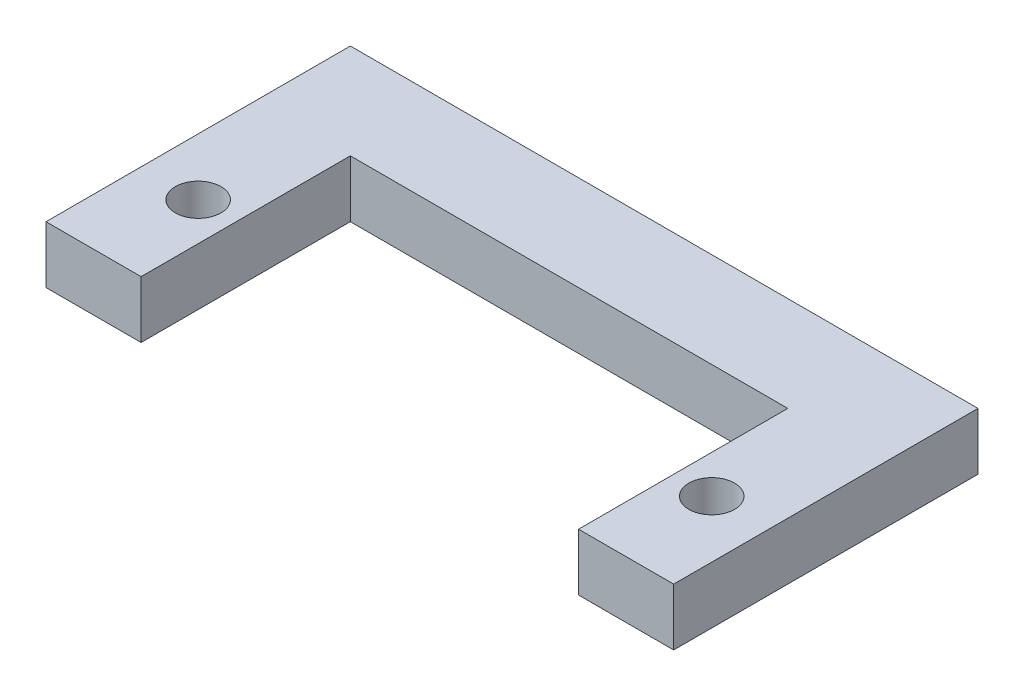
from build123d import *

# Parameters (mm, degrees)
SKETCH4_R           = 1.2
BOSS_EXTRUDE3_DEPTH = 3


with BuildPart() as part:
    # Sketch4 → Boss-Extrude3 (new body)
    with BuildSketch(Plane(origin=(0, 0, 0), x_dir=(1, 0, 0), z_dir=(0, 1, 0))):
        Polygon((5, -5), (28, -5), (28, -16), (33, -16), (33, 0), (0, 0), (0, -16), (5, -16), align=None)
        with Locations(Location((3, -11, 0), (0, 0, 270))):
            Circle(SKETCH4_R, mode=Mode.SUBTRACT)
        with Locations(Location((30, -11, 0), (0, 0, 270))):
            Circle(SKETCH4_R, mode=Mode.SUBTRACT)
    extrude(amount=BOSS_EXTRUDE3_DEPTH)


solid = part.part
